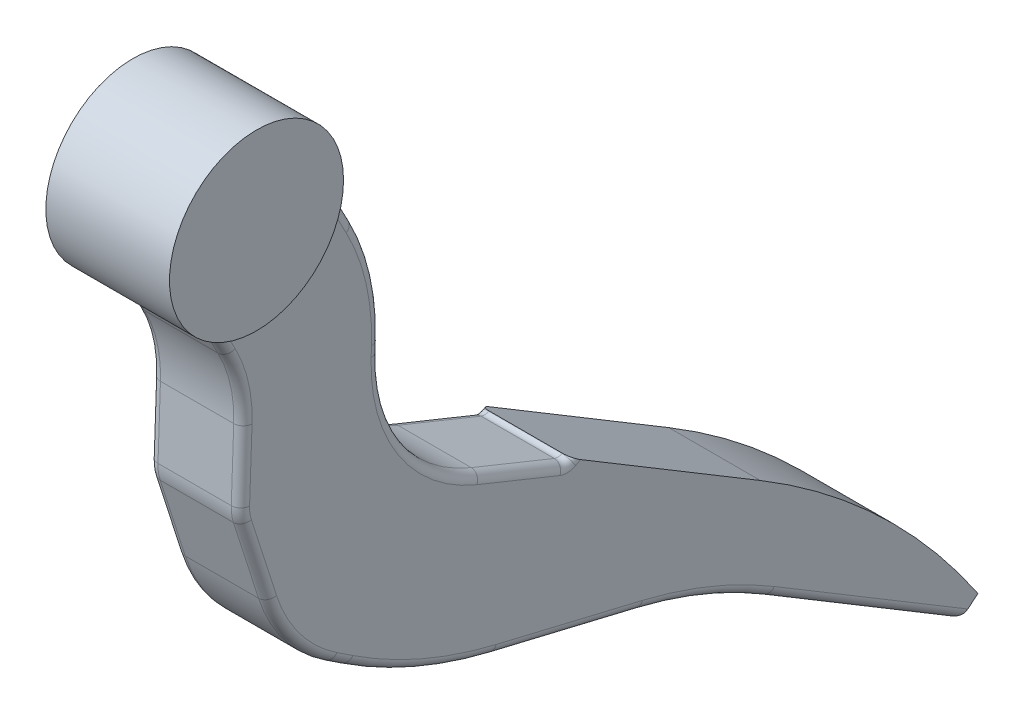
from build123d import *

# Parameters (mm, degrees)
SKETCH1_R           = 19
BOSS_EXTRUDE1_DEPTH = 27
CUT_EXTRUDE1_START  = -27
SKETCH2_R           = 3
CUT_EXTRUDE1_DEPTH  = 20
BOSS_EXTRUDE2_START = 4
BOSS_EXTRUDE2_DEPTH = 20
FILLET1_R           = 50
FILLET2_R           = 30
FILLET3_R           = 10
FILLET4_R           = 35
FILLET5_R           = 100
FILLET6_R           = 35
FILLET7_R           = 2
FILLET8_R           = 2


with BuildPart() as part:
    # Sketch1 → Boss-Extrude1 (new body)
    with BuildSketch(Plane(origin=(0, 0, 0), x_dir=(0, 0, -1), z_dir=(1, 0, 0))):
        Circle(SKETCH1_R)
    extrude(amount=BOSS_EXTRUDE1_DEPTH)

    # Sketch2 → Cut-Extrude1 (cut)
    with BuildSketch(Plane(origin=(27, 0, 0), x_dir=(0, 0, -1), z_dir=(1, 0, 0)).offset(CUT_EXTRUDE1_START)):
        Circle(SKETCH2_R)
    extrude(amount=CUT_EXTRUDE1_DEPTH, mode=Mode.SUBTRACT)

    # Sketch3 → Boss-Extrude2 (add)
    with BuildSketch(Plane(origin=(0, 0, 0), x_dir=(0, 0, -1), z_dir=(1, 0, 0)).offset(BOSS_EXTRUDE2_START)):
        with BuildLine():
            Line((18.894443628, -2), (30.571757329, -24.105210805))
            Line((30.571757329, -24.105210805), (29.160101789, -64.105210805))
            Line((29.160101789, -64.105210805), (70.877132442, -80.977950757))
            Line((70.877132442, -80.977950757), (71.761340874, -80.510858209))
            Line((71.761340874, -80.510858209), (113.01650789, -105.296253694))
            ThreePointArc((113.01650789, -105.296253694), (139.2516778, -125.255736415), (160.530160786, -150.432933488))
            Line((160.530160786, -150.432933488), (156.644610862, -153.579757568))
            Line((156.644610862, -153.579757568), (101.784019397, -120.620456846))
            Line((101.784019397, -120.620456846), (37.657121196, -105.296253694))
            Line((37.657121196, -105.296253694), (9.210363464, -86.510744513))
            Line((9.210363464, -86.510744513), (-0.574058656, -56.0433015))
            Line((-0.574058656, -56.0433015), (0.308226057, -31.0433015))
            Line((0.308226057, -31.0433015), (-6.698162164, -17.780175017))
            Line((-6.698162164, -17.780175017), (18.894443628, -2))
        make_face()
    extrude(amount=BOSS_EXTRUDE2_DEPTH)

    # Fillet1
    fillet1_edges = [part.edges().sort_by_distance(p)[0] for p in [
        (14, -24.105210805, -30.571757329),
    ]]
    fillet(fillet1_edges, radius=FILLET1_R)

    # Fillet2
    fillet2_edges = [part.edges().sort_by_distance(p)[0] for p in [
        (14, -31.0433015, -0.308226057),
    ]]
    fillet(fillet2_edges, radius=FILLET2_R)

    # Fillet3
    fillet3_edges = [part.edges().sort_by_distance(p)[0] for p in [
        (14, -56.0433015, 0.574058656),
    ]]
    fillet(fillet3_edges, radius=FILLET3_R)

    # Fillet4
    fillet4_edges = [part.edges().sort_by_distance(p)[0] for p in [
        (14, -86.510744513, -9.210363464),
    ]]
    fillet(fillet4_edges, radius=FILLET4_R)

    # Fillet5
    fillet5_edges = [part.edges().sort_by_distance(p)[0] for p in [
        (14, -105.296253694, -37.657121196),
        (14, -120.620456846, -101.784019397),
    ]]
    fillet(fillet5_edges, radius=FILLET5_R)

    # Fillet6
    fillet6_edges = [part.edges().sort_by_distance(p)[0] for p in [
        (14, -64.105210805, -29.160101789),
    ]]
    fillet(fillet6_edges, radius=FILLET6_R)

    # Fillet7
    fillet7_edges = [part.edges().sort_by_distance(p)[0] for p in [
        (14, -80.977950757, -70.877132442),
    ]]
    fillet(fillet7_edges, radius=FILLET7_R)

    # Fillet8
    fillet8_edges = [part.edges().sort_by_distance(p)[0] for p in [
        (4, -20.874395385, 5.063607207),
        (14, -153.579757568, -156.644610862),
        (4, -80.527255596, -71.730300543),
        (24, -20.874395385, 5.063607207),
        (24, -80.527255596, -71.730300543),
        (4, -7.157033947, -21.61870189),
        (24, -7.157033947, -21.61870189),
        (4, -24.495759346, -28.868208254),
        (24, -24.495759346, -28.868208254),
        (4, -46.668154937, 0.243196716),
        (24, -46.668154937, 0.243196716),
        (4, -31.277630624, 0.713903389),
        (24, -31.277630624, 0.713903389),
        (4, -66.24854061, -2.70328783),
        (24, -66.24854061, -2.70328783),
        (4, -56.022494361, 0.423944925),
        (24, -56.022494361, 0.423944925),
        (4, -94.437046571, -21.213104097),
        (24, -94.437046571, -21.213104097),
        (4, -85.240499997, -10.884930764),
        (24, -85.240499997, -10.884930764),
        (4, -141.076434231, -135.832891606),
        (24, -141.076434231, -135.832891606),
        (4, -113.212895767, -70.785741018),
        (24, -113.212895767, -70.785741018),
        (4, -103.880894632, -38.270767893),
        (24, -103.880894632, -38.270767893),
        (4, -121.717757742, -101.335811711),
        (24, -121.717757742, -101.335811711),
        (4, -38.522680641, -30.0629448),
        (24, -38.522680641, -30.0629448),
        (4, -59.899123869, -35.642159411),
        (24, -59.899123869, -35.642159411),
        (4, -76.961765139, -60.947308417),
        (24, -76.961765139, -60.947308417),
        (4, -80.772653132, -70.866688464),
        (24, -80.772653132, -70.866688464),
    ]]
    fillet(fillet8_edges, radius=FILLET8_R)


solid = part.part
